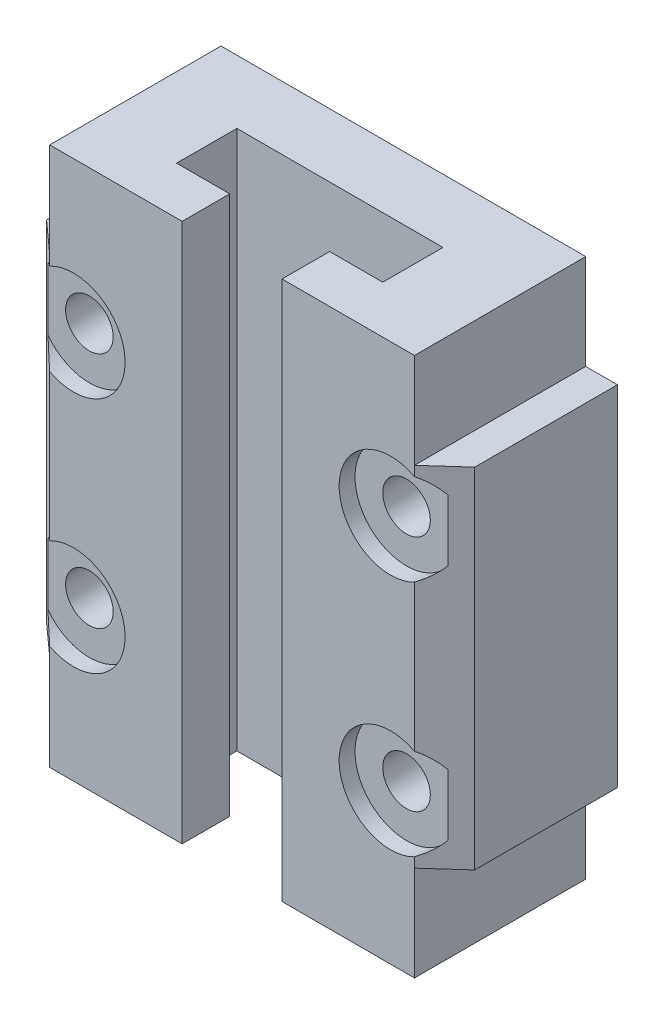
from build123d import *

# Parameters (mm, degrees)
SKETCH_1_W          = 23
SKETCH_1_H          = 10.8
EXTRUDE_1_DEPTH     = 34
CUT_EXTRUDE_1_DEPTH = 37.296143046
SKETCH_3_W          = 7
SKETCH_3_H          = 22
EXTRUDE_2_DEPTH     = 9
EXTRUDE_3_DEPTH     = 22
SKETCH_7_R          = 3.25
CUT_EXTRUDE_7_DEPTH = 1
CUT_EXTRUDE_8_REACH = 39.872
SKETCH_8_R          = 1.5


with BuildPart() as part:
    # 草图1 → 凸台-拉伸1 (new body)
    with BuildSketch(Plane(origin=(0, 0, 0), x_dir=(1, 0, 0), z_dir=(0, 1, 0))):
        Rectangle(SKETCH_1_W, SKETCH_1_H)
    extrude(amount=EXTRUDE_1_DEPTH)

    # 草图2 → 切除-拉伸1 (cut, through all)
    with BuildSketch(Plane(origin=(0, 34, 0), x_dir=(1, 0, 0), z_dir=(0, 1, 0))):
        Polygon((-6.5, 1.4), (6.5, 1.4), (6.5, -2.4), (3.15, -2.4), (3.15, -5.4), (-3.15, -5.4), (-3.15, -2.4), (-6.5, -2.4), align=None)
    extrude(amount=-CUT_EXTRUDE_1_DEPTH, mode=Mode.SUBTRACT)

    # 草图3 → 凸台-拉伸2 (add)
    with BuildSketch(Plane(origin=(0, 0, -5.4), x_dir=(-1, 0, 0), z_dir=(0, 0, -1))):
        with Locations((-10, 17)):
            Rectangle(SKETCH_3_W, SKETCH_3_H)
        with Locations((10, 17)):
            Rectangle(SKETCH_3_W, SKETCH_3_H)
    extrude(amount=-EXTRUDE_2_DEPTH)

    # 草图5 → 凸台-拉伸3 (add)
    with BuildSketch(Plane.XZ.offset(-6)):
        Polygon((11.5, 5.4), (11.5, 3.6), (13.5, 3.6), align=None)
        Polygon((-13.5, 3.6), (-11.5, 5.4), (-11.5, 3.6), align=None)
    extrude(amount=-EXTRUDE_3_DEPTH)

    # 草图7 → 切除-拉伸7 (cut)
    with BuildSketch(Plane.XY.offset(5.4)):
        with Locations((-10, 24.5)):
            Circle(SKETCH_7_R)
        with Locations((-10, 9.5)):
            Circle(SKETCH_7_R)
        with Locations((10, 9.5)):
            Circle(SKETCH_7_R)
        with Locations((10, 24.5)):
            Circle(SKETCH_7_R)
    extrude(amount=-CUT_EXTRUDE_7_DEPTH, mode=Mode.SUBTRACT)

    # 草图8 → 切除-拉伸8 (cut, up to next)
    with BuildSketch(Plane.XY.offset(4.4), mode=Mode.PRIVATE) as cut_extrude_8_sk1:
        with Locations((-10, 24.5)):
            Circle(SKETCH_8_R)
    cut_extrude_8_tool1 = extrude(cut_extrude_8_sk1.sketch, amount=-CUT_EXTRUDE_8_REACH, mode=Mode.PRIVATE) & part.part
    # 草图8 → 切除-拉伸8 (cut, up to next)
    with BuildSketch(Plane.XY.offset(4.4), mode=Mode.PRIVATE) as cut_extrude_8_sk2:
        with Locations((10, 24.5)):
            Circle(SKETCH_8_R)
    cut_extrude_8_tool2 = extrude(cut_extrude_8_sk2.sketch, amount=-CUT_EXTRUDE_8_REACH, mode=Mode.PRIVATE) & part.part
    # 草图8 → 切除-拉伸8 (cut, up to next)
    with BuildSketch(Plane.XY.offset(4.4), mode=Mode.PRIVATE) as cut_extrude_8_sk3:
        with Locations((-10, 9.5)):
            Circle(SKETCH_8_R)
    cut_extrude_8_tool3 = extrude(cut_extrude_8_sk3.sketch, amount=-CUT_EXTRUDE_8_REACH, mode=Mode.PRIVATE) & part.part
    # 草图8 → 切除-拉伸8 (cut, up to next)
    with BuildSketch(Plane.XY.offset(4.4), mode=Mode.PRIVATE) as cut_extrude_8_sk4:
        with Locations((10, 9.5)):
            Circle(SKETCH_8_R)
    cut_extrude_8_tool4 = extrude(cut_extrude_8_sk4.sketch, amount=-CUT_EXTRUDE_8_REACH, mode=Mode.PRIVATE) & part.part
    add(cut_extrude_8_tool1.solids().sort_by_distance((-10, 24.5, 4.4))[0], mode=Mode.SUBTRACT)
    add(cut_extrude_8_tool2.solids().sort_by_distance((10, 24.5, 4.4))[0], mode=Mode.SUBTRACT)
    add(cut_extrude_8_tool3.solids().sort_by_distance((-10, 9.5, 4.4))[0], mode=Mode.SUBTRACT)
    add(cut_extrude_8_tool4.solids().sort_by_distance((10, 9.5, 4.4))[0], mode=Mode.SUBTRACT)


solid = part.part
